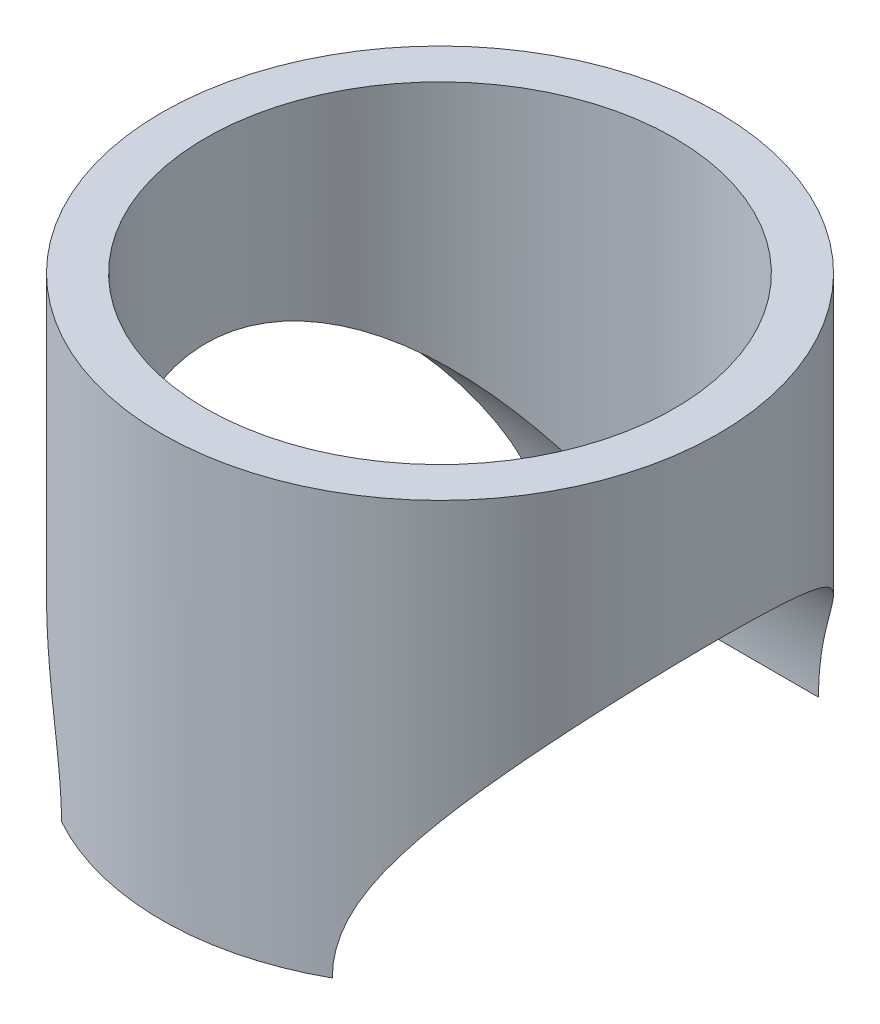
from build123d import *

# Parameters (mm, degrees)
SKETCH1_R           = 24.13
SKETCH1_R_2         = 20.32
BOSS_EXTRUDE1_DEPTH = 18.25625
SKETCH6_W           = 21.082
SKETCH6_H           = 24.13


with BuildPart() as part:
    # Sketch1 → Boss-Extrude1 (new, symmetric)
    with BuildSketch(Plane(origin=(0, 0, 0), x_dir=(1, 0, 0), z_dir=(0, 1, 0))):
        with Locations(Location((0, 0, 0), (0, 0, 270))):
            Circle(SKETCH1_R)
        with Locations(Location((0, 0, 0), (0, 0, 270))):
            Circle(SKETCH1_R_2, mode=Mode.SUBTRACT)
    extrude(amount=BOSS_EXTRUDE1_DEPTH, both=True)

    # Sketch6 → 3/32 (1.66) Dowel Hole1 (revolve, cut)
    with BuildSketch(Plane(origin=(0, -18.25625, 0), x_dir=(0, 0, -1), z_dir=(0, 1, 0))):
        with Locations((10.541, 12.065)):
            Rectangle(SKETCH6_W, SKETCH6_H)
    f_3_32_1_66_dowel_hole1 = revolve(axis=Axis((6.35, -18.25625, 0), (-1, 0, 0)), mode=Mode.SUBTRACT)

    # Mirror1: 3/32 (1.66) Dowel Hole1 across plane
    add(f_3_32_1_66_dowel_hole1.mirror(Plane(origin=(0, 0, 0), x_dir=(0, 0, 1), z_dir=(1, 0, 0))), mode=Mode.SUBTRACT)


solid = part.part
